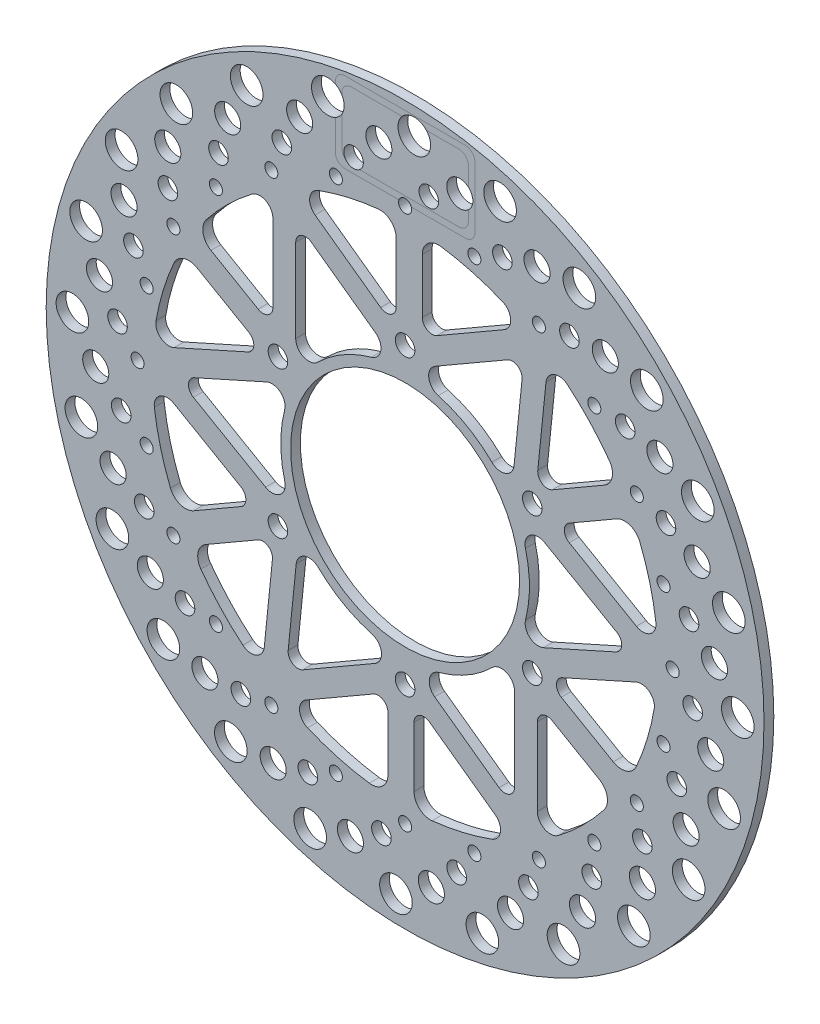
from build123d import *

# Parameters (mm, degrees)
SKETCH1_R           = 110
SKETCH1_R_2         = 3
SKETCH1_R_3         = 35.1
BOSS_EXTRUDE1_DEPTH = 3
SKETCH2_R           = 5
SKETCH2_R_2         = 4
SKETCH2_R_3         = 3
SKETCH2_R_4         = 2
CUT_EXTRUDE1_DEPTH  = 10
CUT_EXTRUDE2_DEPTH  = 13


with BuildPart() as part:
    # Sketch1 → Boss-Extrude1 (new body)
    with BuildSketch(Plane.XY):
        Circle(SKETCH1_R)
        with Locations((0, 45)):
            Circle(SKETCH1_R_2, mode=Mode.SUBTRACT)
        with Locations((38.97114317, 22.5)):
            Circle(SKETCH1_R_2, mode=Mode.SUBTRACT)
        with Locations((38.97114317, -22.5)):
            Circle(SKETCH1_R_2, mode=Mode.SUBTRACT)
        with Locations((0, -45)):
            Circle(SKETCH1_R_2, mode=Mode.SUBTRACT)
        with Locations((-38.97114317, -22.5)):
            Circle(SKETCH1_R_2, mode=Mode.SUBTRACT)
        with Locations((-38.97114317, 22.5)):
            Circle(SKETCH1_R_2, mode=Mode.SUBTRACT)
        Circle(SKETCH1_R_3, mode=Mode.SUBTRACT)
    extrude(amount=BOSS_EXTRUDE1_DEPTH)

    # Sketch2 → Cut-Extrude1 (cut)
    with BuildSketch(Plane.XY.offset(3)):
        with Locations((29.099720892, 97.760964827)):
            Circle(SKETCH2_R)
        with Locations((16.761959362, 93.664668889)):
            Circle(SKETCH2_R_2)
        with Locations((7.251714456, 88.136989282)):
            Circle(SKETCH2_R_3)
        with Locations((0, 82)):
            Circle(SKETCH2_R_4)
        with Locations((21.223161698, 79.205917756)):
            Circle(SKETCH2_R_4)
        with Locations((29.816149682, 83.256912388)):
            Circle(SKETCH2_R_3)
        with Locations((40.433009608, 86.134808375)):
            Circle(SKETCH2_R_2)
        with Locations((53.410571513, 86.898278756)):
            Circle(SKETCH2_R)
        with Locations((41, 71.01408311)):
            Circle(SKETCH2_R_4)
        with Locations((50.348663581, 72.703014503)):
            Circle(SKETCH2_R_3)
        with Locations((61.348617069, 72.735003014)):
            Circle(SKETCH2_R_2)
        with Locations((74.081579949, 70.113618593)):
            Circle(SKETCH2_R)
        with Locations((57.982756057, 57.982756057)):
            Circle(SKETCH2_R_4)
        with Locations((67.449999262, 57.194526327)):
            Circle(SKETCH2_R_3)
        with Locations((78.08341766, 54.378427398)):
            Circle(SKETCH2_R_2)
        with Locations((89.704051138, 48.550831191)):
            Circle(SKETCH2_R)
        with Locations((71.01408311, 41)):
            Circle(SKETCH2_R_4)
        with Locations((79.954728959, 37.788325701)):
            Circle(SKETCH2_R_3)
        with Locations((89.496962376, 32.31605182)):
            Circle(SKETCH2_R_2)
        with Locations((99.213339485, 23.679384878)):
            Circle(SKETCH2_R)
        with Locations((79.205917756, 21.223161698)):
            Circle(SKETCH2_R_4)
        with Locations((87.010676009, 15.806913126)):
            Circle(SKETCH2_R_3)
        with Locations((94.811437007, 8.051390715)):
            Circle(SKETCH2_R_2)
        with Locations((101.961402704, -2.805772383)):
            Circle(SKETCH2_R)
        with Locations((82, 0)):
            Circle(SKETCH2_R_4)
        with Locations((88.136989282, -7.251714456)):
            Circle(SKETCH2_R_3)
        with Locations((93.664668889, -16.761959362)):
            Circle(SKETCH2_R_2)
        with Locations((97.760964827, -29.099720892)):
            Circle(SKETCH2_R)
        with Locations((79.205917756, -21.223161698)):
            Circle(SKETCH2_R_4)
        with Locations((83.256912388, -29.816149682)):
            Circle(SKETCH2_R_3)
        with Locations((86.134808375, -40.433009608)):
            Circle(SKETCH2_R_2)
        with Locations((86.898278756, -53.410571513)):
            Circle(SKETCH2_R)
        with Locations((71.01408311, -41)):
            Circle(SKETCH2_R_4)
        with Locations((72.703014503, -50.348663581)):
            Circle(SKETCH2_R_3)
        with Locations((72.735003014, -61.348617069)):
            Circle(SKETCH2_R_2)
        with Locations((70.113618593, -74.081579949)):
            Circle(SKETCH2_R)
        with Locations((57.982756057, -57.982756057)):
            Circle(SKETCH2_R_4)
        with Locations((57.194526327, -67.449999262)):
            Circle(SKETCH2_R_3)
        with Locations((54.378427398, -78.08341766)):
            Circle(SKETCH2_R_2)
        with Locations((48.550831191, -89.704051138)):
            Circle(SKETCH2_R)
        with Locations((41, -71.01408311)):
            Circle(SKETCH2_R_4)
        with Locations((37.788325701, -79.954728959)):
            Circle(SKETCH2_R_3)
        with Locations((32.31605182, -89.496962376)):
            Circle(SKETCH2_R_2)
        with Locations((23.679384878, -99.213339485)):
            Circle(SKETCH2_R)
        with Locations((21.223161698, -79.205917756)):
            Circle(SKETCH2_R_4)
        with Locations((15.806913126, -87.010676009)):
            Circle(SKETCH2_R_3)
        with Locations((8.051390715, -94.811437007)):
            Circle(SKETCH2_R_2)
        with Locations((-2.805772383, -101.961402704)):
            Circle(SKETCH2_R)
        with Locations((0, -82)):
            Circle(SKETCH2_R_4)
        with Locations((-7.251714456, -88.136989282)):
            Circle(SKETCH2_R_3)
        with Locations((-16.761959362, -93.664668889)):
            Circle(SKETCH2_R_2)
        with Locations((-29.099720892, -97.760964827)):
            Circle(SKETCH2_R)
        with Locations((-21.223161698, -79.205917756)):
            Circle(SKETCH2_R_4)
        with Locations((-29.816149682, -83.256912388)):
            Circle(SKETCH2_R_3)
        with Locations((-40.433009608, -86.134808375)):
            Circle(SKETCH2_R_2)
        with Locations((-53.410571513, -86.898278756)):
            Circle(SKETCH2_R)
        with Locations((-41, -71.01408311)):
            Circle(SKETCH2_R_4)
        with Locations((-50.348663581, -72.703014503)):
            Circle(SKETCH2_R_3)
        with Locations((-61.348617069, -72.735003014)):
            Circle(SKETCH2_R_2)
        with Locations((-74.081579949, -70.113618593)):
            Circle(SKETCH2_R)
        with Locations((-57.982756057, -57.982756057)):
            Circle(SKETCH2_R_4)
        with Locations((-67.449999262, -57.194526327)):
            Circle(SKETCH2_R_3)
        with Locations((-78.08341766, -54.378427398)):
            Circle(SKETCH2_R_2)
        with Locations((-89.704051138, -48.550831191)):
            Circle(SKETCH2_R)
        with Locations((-71.01408311, -41)):
            Circle(SKETCH2_R_4)
        with Locations((-79.954728959, -37.788325701)):
            Circle(SKETCH2_R_3)
        with Locations((-89.496962376, -32.31605182)):
            Circle(SKETCH2_R_2)
        with Locations((-99.213339485, -23.679384878)):
            Circle(SKETCH2_R)
        with Locations((-79.205917756, -21.223161698)):
            Circle(SKETCH2_R_4)
        with Locations((-87.010676009, -15.806913126)):
            Circle(SKETCH2_R_3)
        with Locations((-94.811437007, -8.051390715)):
            Circle(SKETCH2_R_2)
        with Locations((-101.961402704, 2.805772383)):
            Circle(SKETCH2_R)
        with Locations((-82, 0)):
            Circle(SKETCH2_R_4)
        with Locations((-88.136989282, 7.251714456)):
            Circle(SKETCH2_R_3)
        with Locations((-93.664668889, 16.761959362)):
            Circle(SKETCH2_R_2)
        with Locations((-97.760964827, 29.099720892)):
            Circle(SKETCH2_R)
        with Locations((-79.205917756, 21.223161698)):
            Circle(SKETCH2_R_4)
        with Locations((-83.256912388, 29.816149682)):
            Circle(SKETCH2_R_3)
        with Locations((-86.134808374, 40.433009608)):
            Circle(SKETCH2_R_2)
        with Locations((-86.898278756, 53.410571513)):
            Circle(SKETCH2_R)
        with Locations((-71.01408311, 41)):
            Circle(SKETCH2_R_4)
        with Locations((-72.703014503, 50.348663581)):
            Circle(SKETCH2_R_3)
        with Locations((-72.735003014, 61.348617069)):
            Circle(SKETCH2_R_2)
        with Locations((-70.113618593, 74.081579949)):
            Circle(SKETCH2_R)
        with Locations((-57.982756057, 57.982756057)):
            Circle(SKETCH2_R_4)
        with Locations((-57.194526327, 67.449999262)):
            Circle(SKETCH2_R_3)
        with Locations((-54.378427398, 78.08341766)):
            Circle(SKETCH2_R_2)
        with Locations((-48.550831191, 89.704051138)):
            Circle(SKETCH2_R)
        with Locations((-41, 71.01408311)):
            Circle(SKETCH2_R_4)
        with Locations((-37.788325701, 79.954728959)):
            Circle(SKETCH2_R_3)
        with Locations((-32.31605182, 89.496962376)):
            Circle(SKETCH2_R_2)
        with Locations((-23.679384878, 99.213339485)):
            Circle(SKETCH2_R)
        with Locations((-21.223161698, 79.205917756)):
            Circle(SKETCH2_R_4)
        with Locations((-15.806913126, 87.010676009)):
            Circle(SKETCH2_R_3)
        with Locations((-8.051390715, 94.811437007)):
            Circle(SKETCH2_R_2)
        with Locations((2.805772383, 101.961402704)):
            Circle(SKETCH2_R)
    extrude(amount=-CUT_EXTRUDE1_DEPTH, mode=Mode.SUBTRACT)

    # Sketch3 → Cut-Extrude2 (cut)
    with BuildSketch(Plane.XY.offset(3)):
        with BuildLine():
            Line((-28.774346173, 58.00327704), (-11.58348709, 45.597107888))
            Line((-11.58348709, 45.597107888), (-9.054531376, 43.772030257))
            ThreePointArc((-9.054531376, 43.772030257), (-7.456775153, 39.830002482), (-10.312630598, 36.677781423))
            ThreePointArc((-10.312630598, 36.677781423), (-19.120686747, 32.954655791), (-26.724243854, 27.155566472))
            ThreePointArc((-26.724243854, 27.155566472), (-31.075451676, 26.317182875), (-33.529938747, 30.006544579))
            Line((-33.529938747, 30.006544579), (-33.529938747, 34.679649579))
            Line((-33.529938747, 34.679649579), (-33.529938747, 55.5706047))
            ThreePointArc((-33.529938747, 55.5706047), (-31.896178528, 58.241445179), (-28.774346173, 58.00327704))
        make_face()
        with BuildLine():
            Line((-27.592200284, 65.782636859), (-7.487104417, 51.273343348))
            ThreePointArc((-7.487104417, 51.273343348), (-4.365272063, 51.03517521), (-2.731511844, 53.706015689))
            Line((-2.731511844, 53.706015689), (-2.731511844, 72.086571042))
            ThreePointArc((-2.731511844, 72.086571042), (-4.389808578, 75.805847757), (-8.264719557, 77.0580587))
            ThreePointArc((-8.264719557, 77.0580587), (-17.575660768, 75.480766746), (-26.62563659, 72.78272787))
            ThreePointArc((-26.62563659, 72.78272787), (-29.213815445, 69.573323875), (-27.592200284, 65.782636859))
        make_face()
        with BuildLine():
            Line((9.768488156, 52.439781358), (30.3587951, 64.327600615))
            ThreePointArc((30.3587951, 64.327600615), (32.350682771, 68.046325136), (29.902461509, 71.481836919))
            ThreePointArc((29.902461509, 71.481836919), (20.605664283, 74.694155146), (10.976813554, 76.702801629))
            ThreePointArc((10.976813554, 76.702801629), (6.99294446, 75.530901428), (5.268488156, 71.753228402))
            Line((5.268488156, 71.753228402), (5.268488156, 55.03785757))
            ThreePointArc((5.268488156, 55.03785757), (6.768488156, 52.439781358), (9.768488156, 52.439781358))
        make_face()
        with BuildLine():
            Line((43.173334506, 56.786864822), (40.660465668, 32.1206943))
            ThreePointArc((40.660465668, 32.1206943), (42.015122187, 29.298024106), (45.145018001, 29.218566492))
            Line((45.145018001, 29.218566492), (61.063045872, 38.408844168))
            ThreePointArc((61.063045872, 38.408844168), (63.454885624, 41.704609625), (62.601876622, 45.686486442))
            ThreePointArc((62.601876622, 45.686486442), (56.580431115, 52.961352087), (49.718872997, 59.449841614))
            ThreePointArc((49.718872997, 59.449841614), (45.645358179, 60.086568255), (43.173334506, 56.786864822))
        make_face()
        with BuildLine():
            Line((50.298426903, 22.956284202), (64.774362678, 31.313969618))
            ThreePointArc((64.774362678, 31.313969618), (68.908151638, 31.709383164), (71.914981529, 28.845201424))
            ThreePointArc((71.914981529, 28.845201424), (74.989868013, 19.502048842), (76.856317435, 9.844627157))
            ThreePointArc((76.856317435, 9.844627157), (75.105187588, 6.006649459), (70.888733847, 5.872312522))
            Line((70.888733847, 5.872312522), (50.298426903, 17.760131779))
            ThreePointArc((50.298426903, 17.760131779), (48.798426903, 20.35820799), (50.298426903, 22.956284202))
        make_face()
        with BuildLine():
            Line((70.76553479, -8.995772037), (48.147570085, -19.152649048))
            ThreePointArc((48.147570085, -19.152649048), (46.38039425, -21.737151105), (47.876529844, -24.487449197))
            Line((47.876529844, -24.487449197), (63.794557716, -33.677726874))
            ThreePointArc((63.794557716, -33.677726874), (67.844694202, -34.101238133), (70.866596179, -31.371572259))
            ThreePointArc((70.866596179, -31.371572259), (74.156091883, -22.519414659), (76.344509587, -13.332886256))
            ThreePointArc((76.344509587, -13.332886256), (74.859173625, -9.48675562), (70.76553479, -8.995772037))
        make_face()
        with BuildLine():
            Line((45.029938747, -32.081573368), (59.505874521, -40.439258784))
            ThreePointArc((59.505874521, -40.439258784), (61.915207178, -43.821518264), (60.938167975, -47.857600205))
            ThreePointArc((60.938167975, -47.857600205), (54.384203729, -55.192106304), (46.953855926, -61.637209762))
            ThreePointArc((46.953855926, -61.637209762), (42.754504817, -62.039675678), (40.529938747, -58.455288093))
            Line((40.529938747, -58.455288093), (40.529938747, -34.679649579))
            ThreePointArc((40.529938747, -34.679649579), (42.029938747, -32.081573368), (45.029938747, -32.081573368))
        make_face()
        with BuildLine():
            Line((27.592200284, -65.782636859), (7.487104417, -51.273343348))
            ThreePointArc((7.487104417, -51.273343348), (4.365272063, -51.03517521), (2.731511844, -53.706015689))
            Line((2.731511844, -53.706015689), (2.731511844, -72.086571042))
            ThreePointArc((2.731511844, -72.086571042), (4.389808578, -75.805847757), (8.264719557, -77.0580587))
            ThreePointArc((8.264719557, -77.0580587), (17.575660768, -75.480766746), (26.62563659, -72.78272787))
            ThreePointArc((26.62563659, -72.78272787), (29.213815445, -69.573323875), (27.592200284, -65.782636859))
        make_face()
        with BuildLine():
            Line((-5.268488156, -55.03785757), (-5.268488156, -71.753228402))
            ThreePointArc((-5.268488156, -71.753228402), (-6.99294446, -75.530901428), (-10.976813554, -76.702801629))
            ThreePointArc((-10.976813554, -76.702801629), (-20.605664283, -74.694155146), (-29.902461509, -71.481836919))
            ThreePointArc((-29.902461509, -71.481836919), (-32.350682771, -68.046325136), (-30.3587951, -64.327600615))
            Line((-30.3587951, -64.327600615), (-9.768488156, -52.439781358))
            ThreePointArc((-9.768488156, -52.439781358), (-6.768488156, -52.439781358), (-5.268488156, -55.03785757))
        make_face()
        with BuildLine():
            Line((-43.173334506, -56.786864822), (-40.660465668, -32.1206943))
            ThreePointArc((-40.660465668, -32.1206943), (-42.015122187, -29.298024106), (-45.145018001, -29.218566492))
            Line((-45.145018001, -29.218566492), (-61.063045872, -38.408844168))
            ThreePointArc((-61.063045872, -38.408844168), (-63.454885624, -41.704609625), (-62.601876622, -45.686486442))
            ThreePointArc((-62.601876622, -45.686486442), (-56.580431115, -52.961352087), (-49.718872997, -59.449841614))
            ThreePointArc((-49.718872997, -59.449841614), (-45.645358179, -60.086568255), (-43.173334506, -56.786864822))
        make_face()
        with BuildLine():
            Line((-50.298426903, -22.956284202), (-64.774362678, -31.313969618))
            ThreePointArc((-64.774362678, -31.313969618), (-68.908151638, -31.709383164), (-71.914981529, -28.845201424))
            ThreePointArc((-71.914981529, -28.845201424), (-74.989868013, -19.502048842), (-76.856317435, -9.844627157))
            ThreePointArc((-76.856317435, -9.844627157), (-75.105187588, -6.006649459), (-70.888733847, -5.872312522))
            Line((-70.888733847, -5.872312522), (-50.298426903, -17.760131779))
            ThreePointArc((-50.298426903, -17.760131779), (-48.798426903, -20.35820799), (-50.298426903, -22.956284202))
        make_face()
        with BuildLine():
            Line((-70.76553479, 8.995772037), (-48.147570085, 19.152649048))
            ThreePointArc((-48.147570085, 19.152649048), (-46.38039425, 21.737151105), (-47.876529844, 24.487449197))
            Line((-47.876529844, 24.487449197), (-63.794557716, 33.677726874))
            ThreePointArc((-63.794557716, 33.677726874), (-67.844694202, 34.101238133), (-70.866596179, 31.371572259))
            ThreePointArc((-70.866596179, 31.371572259), (-74.156091883, 22.519414659), (-76.344509587, 13.332886256))
            ThreePointArc((-76.344509587, 13.332886256), (-74.859173625, 9.48675562), (-70.76553479, 8.995772037))
        make_face()
        with BuildLine():
            Line((-45.029938747, 32.081573368), (-59.505874521, 40.439258784))
            ThreePointArc((-59.505874521, 40.439258784), (-61.915207178, 43.821518264), (-60.938167975, 47.857600205))
            ThreePointArc((-60.938167975, 47.857600205), (-54.384203729, 55.192106304), (-46.953855926, 61.637209762))
            ThreePointArc((-46.953855926, 61.637209762), (-42.754504817, 62.039675678), (-40.529938747, 58.455288093))
            Line((-40.529938747, 58.455288093), (-40.529938747, 34.679649579))
            ThreePointArc((-40.529938747, 34.679649579), (-42.029938747, 32.081573368), (-45.029938747, 32.081573368))
        make_face()
        with BuildLine():
            Line((13.268488156, 46.377603532), (9.221460512, 44.041051032))
            ThreePointArc((9.221460512, 44.041051032), (7.253623088, 40.070722023), (10.155288492, 36.721657311))
            ThreePointArc((10.155288492, 36.721657311), (18.979225714, 33.036328357), (26.607575168, 27.269890789))
            ThreePointArc((26.607575168, 27.269890789), (30.765406406, 26.372757954), (33.38042449, 29.72746932))
            Line((33.38042449, 29.72746932), (33.696510225, 32.830148028))
            Line((33.696510225, 32.830148028), (35.845138333, 53.920953284))
            ThreePointArc((35.845138333, 53.920953284), (34.490481814, 56.743623478), (31.360586001, 56.823081092))
            Line((31.360586001, 56.823081092), (13.268488156, 46.377603532))
        make_face()
        with BuildLine():
            Line((46.798426903, 11.697953953), (42.751399259, 14.034506453))
            ThreePointArc((42.751399259, 14.034506453), (38.329074764, 13.753539148), (36.879532346, 9.566090839))
            ThreePointArc((36.879532346, 9.566090839), (38.099912462, 0.081672566), (36.920205766, -9.407890634))
            ThreePointArc((36.920205766, -9.407890634), (38.222181559, -13.457244528), (42.434955866, -14.044560938))
            Line((42.434955866, -14.044560938), (45.279997315, -12.76695986))
            Line((45.279997315, -12.76695986), (64.619484506, -4.082323757))
            ThreePointArc((64.619484506, -4.082323757), (66.386660342, -1.4978217), (64.890524748, 1.252476392))
            Line((64.890524748, 1.252476392), (46.798426903, 11.697953953))
        make_face()
        with BuildLine():
            Line((33.529938747, -34.679649579), (33.529938747, -30.006544579))
            ThreePointArc((33.529938747, -30.006544579), (31.075451676, -26.317182875), (26.724243854, -27.155566472))
            ThreePointArc((26.724243854, -27.155566472), (19.120686747, -32.954655791), (10.312630598, -36.677781423))
            ThreePointArc((10.312630598, -36.677781423), (7.456775153, -39.830002482), (9.054531376, -43.772030257))
            Line((9.054531376, -43.772030257), (11.58348709, -45.597107888))
            Line((11.58348709, -45.597107888), (28.774346173, -58.00327704))
            ThreePointArc((28.774346173, -58.00327704), (31.896178528, -58.241445179), (33.529938747, -55.5706047))
            Line((33.529938747, -55.5706047), (33.529938747, -34.679649579))
        make_face()
        with BuildLine():
            Line((-13.268488156, -46.377603532), (-9.221460512, -44.041051032))
            ThreePointArc((-9.221460512, -44.041051032), (-7.253623088, -40.070722023), (-10.155288492, -36.721657311))
            ThreePointArc((-10.155288492, -36.721657311), (-18.979225714, -33.036328357), (-26.607575168, -27.269890789))
            ThreePointArc((-26.607575168, -27.269890789), (-30.765406406, -26.372757954), (-33.38042449, -29.72746932))
            Line((-33.38042449, -29.72746932), (-33.696510225, -32.830148028))
            Line((-33.696510225, -32.830148028), (-35.845138333, -53.920953284))
            ThreePointArc((-35.845138333, -53.920953284), (-34.490481814, -56.743623478), (-31.360586001, -56.823081092))
            Line((-31.360586001, -56.823081092), (-13.268488156, -46.377603532))
        make_face()
        with BuildLine():
            Line((-46.798426903, -11.697953953), (-42.751399259, -14.034506453))
            ThreePointArc((-42.751399259, -14.034506453), (-38.329074764, -13.753539148), (-36.879532346, -9.566090839))
            ThreePointArc((-36.879532346, -9.566090839), (-38.099912462, -0.081672566), (-36.920205766, 9.407890634))
            ThreePointArc((-36.920205766, 9.407890634), (-38.222181559, 13.457244528), (-42.434955866, 14.044560938))
            Line((-42.434955866, 14.044560938), (-45.279997315, 12.76695986))
            Line((-45.279997315, 12.76695986), (-64.619484506, 4.082323757))
            ThreePointArc((-64.619484506, 4.082323757), (-66.386660342, 1.4978217), (-64.890524748, -1.252476392))
            Line((-64.890524748, -1.252476392), (-46.798426903, -11.697953953))
        make_face()
    extrude(amount=-CUT_EXTRUDE2_DEPTH, mode=Mode.SUBTRACT)


solid = part.part
